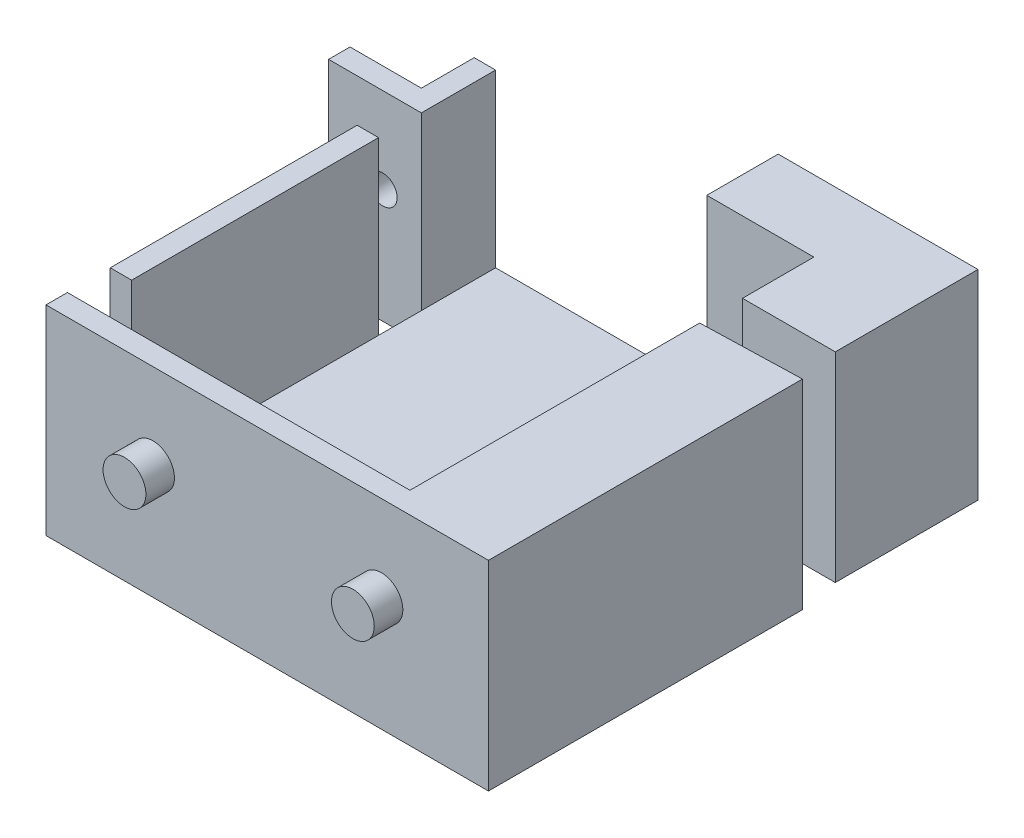
from build123d import *

# Parameters (mm, degrees)
SKETCH_1_W          = 22.5
SKETCH_1_H          = 30
EXTRUDE_1_DEPTH     = 2
SKETCH_2_W          = 22.5
SKETCH_2_H          = 1.5
EXTRUDE_2_DEPTH     = 12
EXTRUDE_4_REACH     = 25.4
SKETCH_3_W          = 1.5
SKETCH_3_H          = 17.3
SKETCH_3_H_2        = 1.5
SKETCH_6_R          = 1.5
EXTRUDE_5_DEPTH     = 2
EXTRUDE_START       = 2
SKETCH_7_R          = 1.5
EXTRUDE_6_DEPTH     = 2
CUT_EXTRUDE_1_REACH = 38.469
SKETCH_8_R          = 1


with BuildPart() as part:
    # 草图1 → 凸台-拉伸1 (new body)
    with BuildSketch(Plane(origin=(0, 0, 0), x_dir=(1, 0, 0), z_dir=(0, 1, 0))):
        Rectangle(SKETCH_1_W, SKETCH_1_H)
    extrude(amount=EXTRUDE_1_DEPTH)

    # 草图2 → 凸台-拉伸2 (add)
    with BuildSketch(Plane(origin=(0, 2, 0), x_dir=(1, 0, 0), z_dir=(0, 1, 0))):
        with Locations((0, -14.25)):
            Rectangle(SKETCH_2_W, SKETCH_2_H)
    extrude(amount=EXTRUDE_2_DEPTH)

    # 凸台-拉伸4: up to this face of the body (flat: up to its plane)
    extrude_4_end = Plane(part.part.faces().sort_by_distance((0, 14, 14.25))[0])
    # 草图3 → 凸台-拉伸4 (add, up to the picked face)
    with BuildSketch(Plane.XZ, mode=Mode.PRIVATE) as extrude_4_sk1:
        Polygon((-11.25, -15), (-12.75, -15), (-12.75, -11.3), (-17.75, -11.3), (-17.75, -9.8), (-12.75, -9.8), (-11.25, -9.8), align=None)
    extrude_4_tool1 = split(extrude(extrude_4_sk1.sketch, amount=-EXTRUDE_4_REACH, mode=Mode.PRIVATE), bisect_by=extrude_4_end, keep=Keep.BOTH, mode=Mode.PRIVATE)
    # 草图3 → 凸台-拉伸4 (add, up to the picked face)
    with BuildSketch(Plane.XZ, mode=Mode.PRIVATE) as extrude_4_sk2:
        with Locations((-12, 1.85)):
            Rectangle(SKETCH_3_W, SKETCH_3_H)
    extrude_4_tool2 = split(extrude(extrude_4_sk2.sketch, amount=-EXTRUDE_4_REACH, mode=Mode.PRIVATE), bisect_by=extrude_4_end, keep=Keep.BOTH, mode=Mode.PRIVATE)
    # 草图3 → 凸台-拉伸4 (add, up to the picked face)
    with BuildSketch(Plane.XZ, mode=Mode.PRIVATE) as extrude_4_sk3:
        with Locations((-12, 14.25)):
            Rectangle(SKETCH_3_W, SKETCH_3_H_2)
    extrude_4_tool3 = split(extrude(extrude_4_sk3.sketch, amount=-EXTRUDE_4_REACH, mode=Mode.PRIVATE), bisect_by=extrude_4_end, keep=Keep.BOTH, mode=Mode.PRIVATE)
    # 草图3 → 凸台-拉伸4 (add, up to the picked face)
    with BuildSketch(Plane.XZ, mode=Mode.PRIVATE) as extrude_4_sk4:
        Polygon((11.25, -9.8), (11.25, -14.8), (3.75, -14.8), (3.75, -19.8), (17.75, -19.8), (17.75, -11.3), (17.75, -9.8), (12.75, -9.8), align=None)
    extrude_4_tool4 = split(extrude(extrude_4_sk4.sketch, amount=-EXTRUDE_4_REACH, mode=Mode.PRIVATE), bisect_by=extrude_4_end, keep=Keep.BOTH, mode=Mode.PRIVATE)
    # 草图3 → 凸台-拉伸4 (add, up to the picked face)
    with BuildSketch(Plane.XZ, mode=Mode.PRIVATE) as extrude_4_sk5:
        Polygon((18.25, -7), (11.25, -6.8), (11.25, 15), (18.25, 15), align=None)
    extrude_4_tool5 = split(extrude(extrude_4_sk5.sketch, amount=-EXTRUDE_4_REACH, mode=Mode.PRIVATE), bisect_by=extrude_4_end, keep=Keep.BOTH, mode=Mode.PRIVATE)
    add(extrude_4_tool1.solids().sort_by(Axis((-12, 0, -14.916759), (0, 1, 0)))[0])
    add(extrude_4_tool2.solids().sort_by(Axis((-12, 0, 1.85), (0, 1, 0)))[0])
    add(extrude_4_tool3.solids().sort_by(Axis((-12, 0, 14.25), (0, 1, 0)))[0])
    add(extrude_4_tool4.solids().sort_by(Axis((11.939024, 0, -15.714634), (0, 1, 0)))[0])
    add(extrude_4_tool5.solids().sort_by(Axis((14.755327, 0, 4.049924), (0, 1, 0)))[0])

    # 草图6 → 凸台-拉伸5 (add)
    with BuildSketch(Plane(origin=(0, 0, -19.8), x_dir=(-1, 0, 0), z_dir=(0, 0, -1))):
        with Locations((-10.75, 8)):
            Circle(SKETCH_6_R)
    extrude(amount=EXTRUDE_5_DEPTH)

    # 草图7 → 凸台-拉伸6 (add)
    with BuildSketch(Plane.XY.offset(15).offset(EXTRUDE_START)):
        with Locations(Location((10.75, 8, 0), (0, 0, 180))):
            Circle(SKETCH_7_R)
        with Locations(Location((-5.25, 8, 0), (0, 0, 180))):
            Circle(SKETCH_7_R)
    extrude(amount=-EXTRUDE_6_DEPTH)

    # 草图8 → 切除-拉伸1 (cut, up to next)
    with BuildSketch(Plane(origin=(0, 0, -11.3), x_dir=(-1, 0, 0), z_dir=(0, 0, -1)), mode=Mode.PRIVATE) as cut_extrude_1_sk1:
        with Locations((13.95, 8)):
            Circle(SKETCH_8_R)
    cut_extrude_1_tool1 = extrude(cut_extrude_1_sk1.sketch, amount=-CUT_EXTRUDE_1_REACH, mode=Mode.PRIVATE) & part.part
    # 草图8 → 切除-拉伸1 (cut, up to next)
    with BuildSketch(Plane(origin=(0, 0, -11.3), x_dir=(-1, 0, 0), z_dir=(0, 0, -1)), mode=Mode.PRIVATE) as cut_extrude_1_sk2:
        with Locations(Location((-13.95, 8, 0), (0, 0, 180))):
            Circle(SKETCH_8_R)
    cut_extrude_1_tool2 = extrude(cut_extrude_1_sk2.sketch, amount=-CUT_EXTRUDE_1_REACH, mode=Mode.PRIVATE) & part.part
    add(cut_extrude_1_tool1.solids().sort_by_distance((-13.95, 8, -11.3))[0], mode=Mode.SUBTRACT)
    add(cut_extrude_1_tool2.solids().sort_by_distance((13.95, 8, -11.3))[0], mode=Mode.SUBTRACT)


solid = part.part
